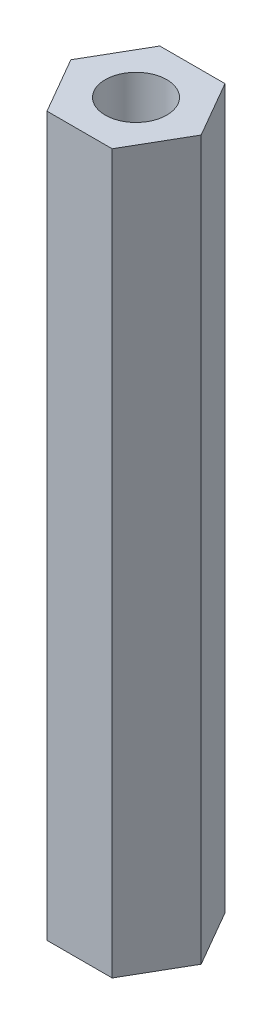
from build123d import *

# Parameters (mm, degrees)
BOSS_EXTRUDE1_DEPTH = 35
SKETCH2_R           = 1.5
CUT_EXTRUDE1_DEPTH  = 10


with BuildPart() as part:
    # Sketch1 → Boss-Extrude1 (new body)
    with BuildSketch(Plane(origin=(0, 0, 0), x_dir=(1, 0, 0), z_dir=(0, 1, 0))):
        Polygon((3.175426481, 0), (1.58771324, 2.75), (-1.58771324, 2.75), (-3.175426481, 0), (-1.58771324, -2.75), (1.58771324, -2.75), align=None)
    extrude(amount=BOSS_EXTRUDE1_DEPTH)

    # Sketch2 → Cut-Extrude1 (cut)
    with BuildSketch(Plane(origin=(0, 35, 0), x_dir=(1, 0, 0), z_dir=(0, 1, 0))):
        with Locations(Location((0, 0, 0), (0, 0, 270))):
            Circle(SKETCH2_R)
    cut_extrude1 = extrude(amount=-CUT_EXTRUDE1_DEPTH, mode=Mode.SUBTRACT)

    # Mirror1: Cut-Extrude1 across plane
    add(cut_extrude1.mirror(Plane(origin=(0, 17.5, 0), x_dir=(0, 0, 1), z_dir=(0, -1, 0))), mode=Mode.SUBTRACT)


solid = part.part
